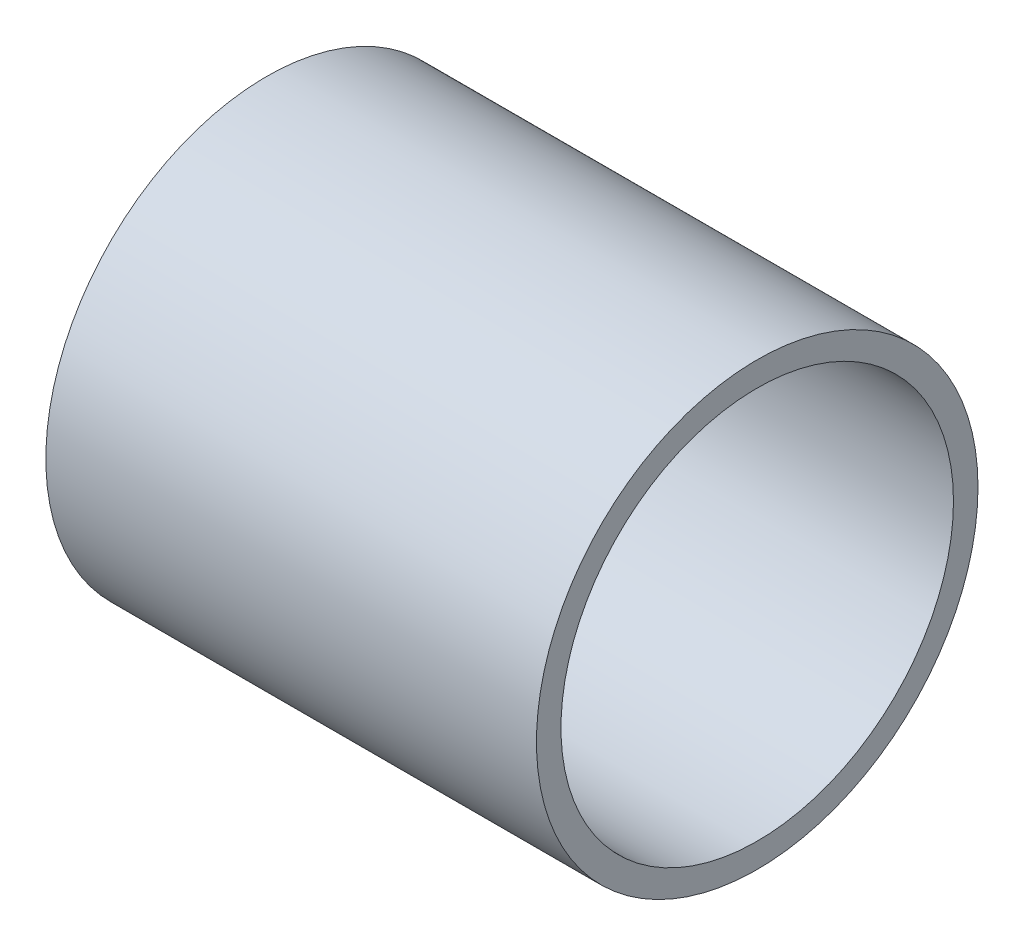
from build123d import *

# Parameters (mm, degrees)
SKETCH2_R           = 2.25
SKETCH2_R_2         = 2
BOSS_EXTRUDE1_DEPTH = 5


with BuildPart() as part:
    # Sketch2 → Boss-Extrude1 (new body)
    with BuildSketch(Plane(origin=(0, 0, 0), x_dir=(0, 0, -1), z_dir=(1, 0, 0))):
        Circle(SKETCH2_R)
        Circle(SKETCH2_R_2, mode=Mode.SUBTRACT)
    extrude(amount=BOSS_EXTRUDE1_DEPTH)


solid = part.part
